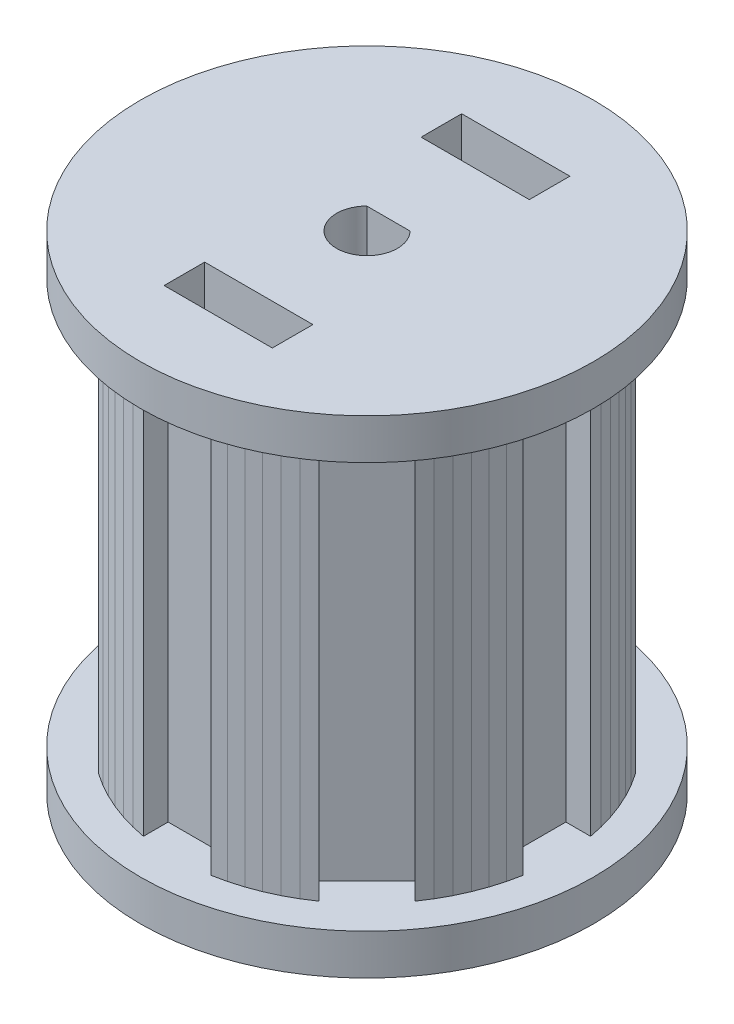
from build123d import *

# Parameters (mm, degrees)
SKETCH1_R           = 16.75
BOSS_EXTRUDE1_DEPTH = 3
SKETCH3_R           = 16.75
BOSS_EXTRUDE2_DEPTH = 3
BOSS_EXTRUDE3_DEPTH = 31
SKETCH7_R           = 1.751351815
CUT_EXTRUDE11_DEPTH = 50
CUT_EXTRUDE1_DEPTH  = 50
SKETCH8_W           = 8
SKETCH8_H           = 3
CUT_EXTRUDE12_DEPTH = 40


with BuildPart() as part:
    # Sketch1 → Boss-Extrude1 (new body)
    with BuildSketch(Plane(origin=(0, -15, 0), x_dir=(1, 0, 0), z_dir=(0, 1, 0))):
        Circle(SKETCH1_R)
    extrude(amount=BOSS_EXTRUDE1_DEPTH)



with BuildPart() as body_2:
    # Sketch3 → Boss-Extrude2 (new body)
    with BuildSketch(Plane(origin=(0, 21, 0), x_dir=(1, 0, 0), z_dir=(0, 1, 0))):
        Circle(SKETCH3_R)
    extrude(amount=-BOSS_EXTRUDE2_DEPTH)


with BuildPart() as part_1:
    add(part.part)

    add(body_2.part)  # Boss-Extrude3 merges body 2
    # Sketch6 → Boss-Extrude3 (add)
    with BuildSketch(Plane(origin=(0, -12, 0), x_dir=(1, 0, 0), z_dir=(0, 1, 0))):
        Polygon((-10.39609313, -6.860559341), (-11.68775931, -8.152225055), (-12.244775891, -7.288892753), (-12.738139369, -6.387668662), (-13.165283017, -5.453239195), (-13.523988426, -4.490460269), (-13.812389225, -3.504338907), (-14.028987847, -2.499999944), (-12.202296406, -2.499999944), (-12.202296406, 2.499999944), (-14.028987847, 2.499999944), (-13.812389225, 3.504338907), (-13.523988426, 4.490460269), (-13.165283017, 5.453239195), (-12.738139369, 6.387668662), (-12.244775891, 7.288892753), (-11.68775931, 8.152225055), (-10.39609313, 6.860559341), (-6.860559341, 10.39609313), (-8.152225055, 11.68775931), (-7.288892753, 12.244775891), (-6.387668662, 12.738139369), (-5.453239195, 13.165283017), (-4.490460269, 13.523988426), (-3.504338907, 13.812389225), (-2.499999944, 14.028987847), (-2.499999944, 12.174172863), (2.499999944, 12.202296406), (2.499999944, 14.028987847), (3.504338907, 13.812389225), (4.490460269, 13.523988426), (5.453239195, 13.165283017), (6.387668662, 12.738139369), (7.288892753, 12.244775891), (8.152225055, 11.68775931), (6.860559341, 10.39609313), (10.39609313, 6.860559341), (11.68775931, 8.152225055), (12.244775891, 7.288892753), (12.738139369, 6.387668662), (13.165283017, 5.453239195), (13.523988426, 4.490460269), (13.812389225, 3.504338907), (14.028987847, 2.499999944), (12.202296406, 2.499999944), (12.202296406, -2.499999944), (14.028987847, -2.499999944), (13.812389225, -3.504338907), (13.523988426, -4.490460269), (13.165283017, -5.453239195), (12.738139369, -6.387668662), (12.244775891, -7.288892753), (11.68775931, -8.152225055), (10.39609313, -6.860559341), (6.860559341, -10.39609313), (8.152225055, -11.68775931), (7.288892753, -12.244775891), (6.387668662, -12.738139369), (5.453239195, -13.165283017), (4.490460269, -13.523988426), (3.504338907, -13.812389225), (2.499999944, -14.028987847), (2.499999944, -12.202296406), (-2.499999944, -12.202296406), (-2.499999944, -14.028987847), (-3.504338907, -13.812389225), (-4.490460269, -13.523988426), (-5.453239195, -13.165283017), (-6.387668662, -12.738139369), (-7.288892753, -12.244775891), (-8.152225055, -11.68775931), (-6.860559341, -10.39609313), align=None)
    extrude(amount=BOSS_EXTRUDE3_DEPTH)

    # Sketch7 → Cut-Extrude11 (cut)
    with BuildSketch(Plane(origin=(-0.068553102, 0, -12.187849043), x_dir=(-0.9999841817006155, 0, 0.005624619858302935), z_dir=(-0.005624619858302935, 0, -0.9999841817006155))):
        with Locations((-0.120761258, 16)):
            Circle(SKETCH7_R)
    extrude(amount=-CUT_EXTRUDE11_DEPTH, mode=Mode.SUBTRACT)

    # Sketch2 → Cut-Extrude1 (cut)
    with BuildSketch(Plane(origin=(0, -15, 0), x_dir=(1, 0, 0), z_dir=(0, 1, 0))):
        with BuildLine():
            Line((1.6, 1.581929202), (-1.6, 1.581929202))
            ThreePointArc((-1.6, 1.581929202), (0, -2.25), (1.6, 1.581929202))
        make_face()
    extrude(amount=CUT_EXTRUDE1_DEPTH, mode=Mode.SUBTRACT)

    # Sketch8 → Cut-Extrude12 (cut)
    with BuildSketch(Plane(origin=(0, -15, 0), x_dir=(1, 0, 0), z_dir=(0, 1, 0))):
        with Locations((0, 9.5)):
            Rectangle(SKETCH8_W, SKETCH8_H)
    cut_extrude12 = extrude(amount=CUT_EXTRUDE12_DEPTH, mode=Mode.SUBTRACT)

    # Mirror1: Cut-Extrude12 across plane
    add(cut_extrude12.mirror(Plane.XY), mode=Mode.SUBTRACT)


solid = part_1.part
